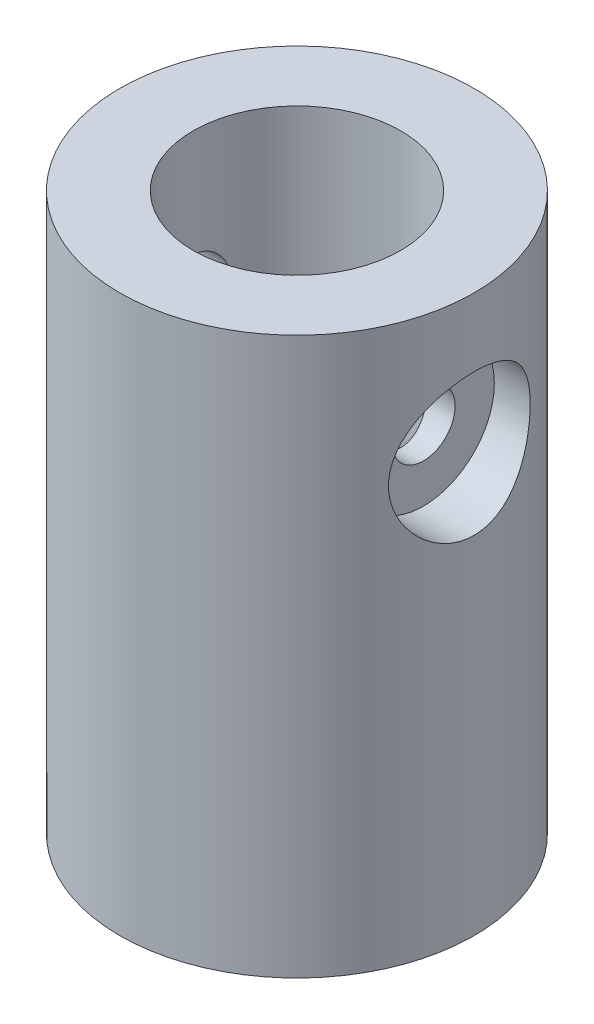
from build123d import *

# Parameters (mm, degrees)
SKETCH1_R                               = 7
BOSS_EXTRUDE1_DEPTH                     = 22
SKETCH2_R                               = 4.1
CUT_EXTRUDE1_DEPTH                      = 14
CUT_EXTRUDE2_DEPTH                      = 8
CBORE_FOR_M5_HEX_HEAD_BOLT1_D           = 2.5
CBORE_FOR_M5_HEX_HEAD_BOLT1_CBORE_D     = 5.6
CBORE_FOR_M5_HEX_HEAD_BOLT1_CBORE_DEPTH = 2


with BuildPart() as part:
    # Sketch1 → Boss-Extrude1 (new body)
    with BuildSketch(Plane(origin=(0, 0, 0), x_dir=(1, 0, 0), z_dir=(0, 1, 0))):
        with Locations(Location((0, 0, 0), (0, 0, 270))):
            Circle(SKETCH1_R)
    extrude(amount=BOSS_EXTRUDE1_DEPTH)

    # Sketch2 → Cut-Extrude1 (cut)
    with BuildSketch(Plane(origin=(0, 22, 0), x_dir=(1, 0, 0), z_dir=(0, 1, 0))):
        with Locations(Location((0, 0, 0), (0, 0, 270))):
            Circle(SKETCH2_R)
    extrude(amount=-CUT_EXTRUDE1_DEPTH, mode=Mode.SUBTRACT)

    # Sketch3 → Cut-Extrude2 (cut)
    with BuildSketch(Plane.XZ):
        with BuildLine():
            Line((-1.95, 2.00935313), (-1.95, -2.00935313))
            ThreePointArc((-1.95, -2.00935313), (0, -2.8), (1.95, -2.00935313))
            Line((1.95, -2.00935313), (1.95, 2.00935313))
            ThreePointArc((1.95, 2.00935313), (0, 2.8), (-1.95, 2.00935313))
        make_face()
    extrude(amount=-CUT_EXTRUDE2_DEPTH, mode=Mode.SUBTRACT)

    # CBORE for M5 Hex Head Bolt1 (through all)
    with Locations(Plane(origin=(7, 16.5, 0), x_dir=(0, 0, 1), z_dir=(1, 0, 0))):
        with Locations((0, 0)):
            CounterBoreHole(CBORE_FOR_M5_HEX_HEAD_BOLT1_D / 2, CBORE_FOR_M5_HEX_HEAD_BOLT1_CBORE_D / 2, CBORE_FOR_M5_HEX_HEAD_BOLT1_CBORE_DEPTH)


solid = part.part
